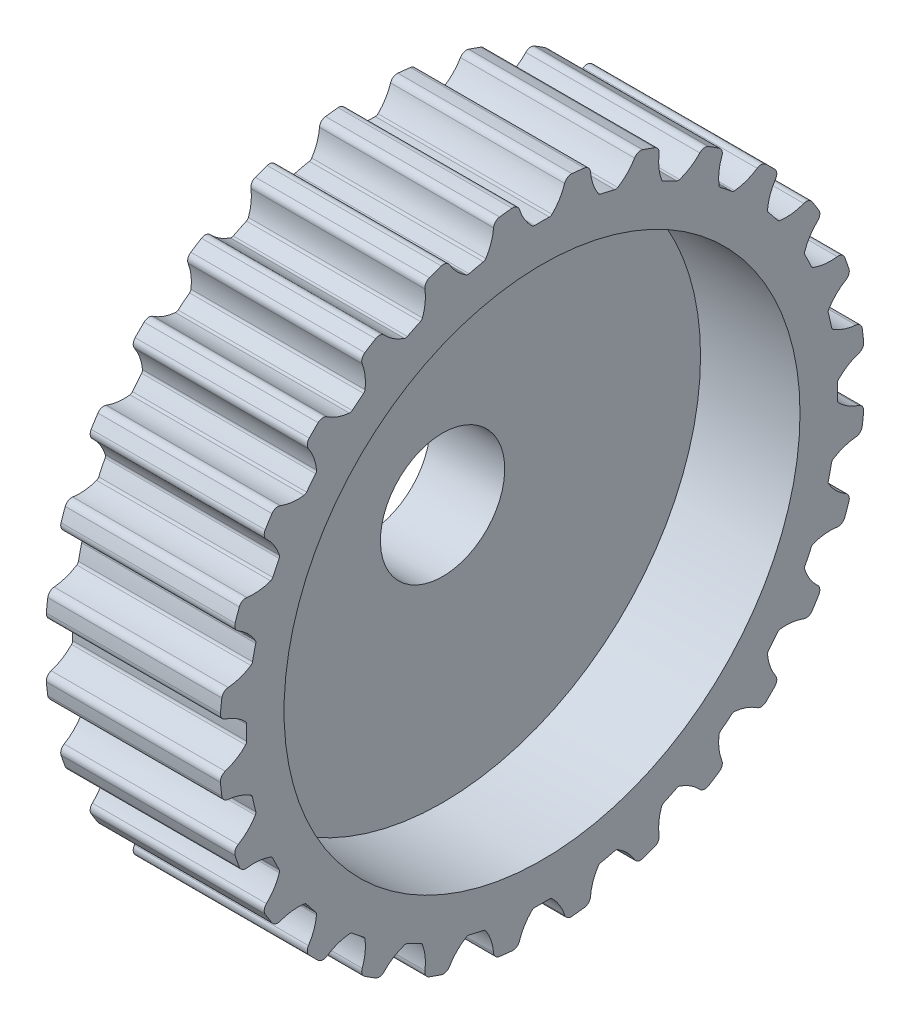
from build123d import *

# Parameters (mm, degrees)
HOLE_WIZARD_1_D          = 5
SKETCH_4_R               = 17.99
CUT_EXTRUDE_1_DEPTH      = 7
CUT_EXTRUDE_2_DEPTH      = 24.895606291
CUT_EXTRUDE_2_DEPTH_BACK = 24.895606291
SKETCH_5_W               = 12.588560779
SKETCH_5_H               = 39.970458518
SKETCH_5_W_2             = 25.674974244
SKETCH_5_H_2             = 50.140877678
SKETCH_6_R               = 10.375
CUT_EXTRUDE_3_DEPTH      = 4


with BuildPart() as part:
    # 草图1 → 旋转1 (revolve)
    with BuildSketch(Plane.XY, mode=Mode.PRIVATE) as revolve_1_sk:
        Polygon((0, 0), (0, 10), (1, 10), (1, 12.858347502), (0.495496297, 14.741180955), (1.461422123, 15), (2, 12.99), (9, 12.99), (9.538577877, 15), (10.504503703, 14.741180955), (10, 12.858347502), (10, 10), (11, 10), (11, 0), align=None)
    revolve(revolve_1_sk.sketch.rotate(Axis((11, 0, 0), (-1, 0, 0)), 270), axis=Axis((11, 0, 0), (-1, 0, 0)))

    # 孔1 (through all)
    with Locations(Plane(origin=(11, 0, 0), x_dir=(0, 0, -1), z_dir=(1, 0, 0))):
        with Locations((0, 0)):
            Hole(HOLE_WIZARD_1_D / 2)

    # 草图4 → 切除-拉伸1 (cut)
    with BuildSketch(Plane(origin=(2, 0, 0), x_dir=(0, 0, -1), z_dir=(1, 0, 0))):
        Circle(SKETCH_4_R)
        with BuildLine():
            ThreePointArc((-12.934335103, 1.201280746), (-12.888789145, 1.020492007), (-12.739828866, 0.908376719))
            ThreePointArc((-12.739828866, 0.908376719), (-12.297942775, 0.706183335), (-11.918804359, 0.402210404))
            ThreePointArc((-11.918804359, 0.402210404), (-11.886657302, 0.352337477), (-11.876364008, 0.293901271))
            ThreePointArc((-11.876364008, 0.293901271), (-11.88, 0), (-11.876364008, -0.293901271))
            ThreePointArc((-11.876364008, -0.293901271), (-11.886657302, -0.352337477), (-11.918804359, -0.402210404))
            ThreePointArc((-11.918804359, -0.402210404), (-12.297942775, -0.706183335), (-12.739828866, -0.908376719))
            ThreePointArc((-12.739828866, -0.908376719), (-12.888789145, -1.020492007), (-12.934335103, -1.201280746))
            ThreePointArc((-12.934335103, -1.201280746), (-12.908321607, -1.454418545), (-12.877354431, -1.706998197))
            ThreePointArc((-12.877354431, -1.706998197), (-12.792721126, -1.873119256), (-12.622547594, -1.9492768))
            ThreePointArc((-12.622547594, -1.9492768), (-12.146748249, -2.048071867), (-11.709475284, -2.260057328))
            ThreePointArc((-11.709475284, -2.260057328), (-11.667036451, -2.301526443), (-11.643997952, -2.356207058))
            ThreePointArc((-11.643997952, -2.356207058), (-11.582143597, -2.643548695), (-11.513199581, -2.929272164))
            ThreePointArc((-11.513199581, -2.929272164), (-11.510231522, -2.988533726), (-11.530474814, -3.044309627))
            ThreePointArc((-11.530474814, -3.044309627), (-11.832467099, -3.425027557), (-12.218281922, -3.720480436))
            ThreePointArc((-12.218281922, -3.720480436), (-12.338559457, -3.86293154), (-12.342734204, -4.049322457))
            ThreePointArc((-12.342734204, -4.049322457), (-12.261044461, -4.290325015), (-12.174649437, -4.529681124))
            ThreePointArc((-12.174649437, -4.529681124), (-12.055172652, -4.672804499), (-11.872319078, -4.70918544))
            ThreePointArc((-11.872319078, -4.70918544), (-11.386465046, -4.699628195), (-10.912984224, -4.808996348))
            ThreePointArc((-10.912984224, -4.808996348), (-10.862381675, -4.839982218), (-10.827753217, -4.888165327))
            ThreePointArc((-10.827753217, -4.888165327), (-10.703510151, -5.154538821), (-10.572715252, -5.417757118))
            ThreePointArc((-10.572715252, -5.417757118), (-10.556634671, -5.474872414), (-10.563959116, -5.533754454))
            ThreePointArc((-10.563959116, -5.533754454), (-10.773662114, -5.972126595), (-11.084059304, -6.346023728))
            ThreePointArc((-11.084059304, -6.346023728), (-11.169622877, -6.511667555), (-11.132217073, -6.694314232))
            ThreePointArc((-11.132217073, -6.694314232), (-10.998947348, -6.911096674), (-10.861456683, -7.125226924))
            ThreePointArc((-10.861456683, -7.125226924), (-10.713127484, -7.238175812), (-10.526762909, -7.232955859))
            ThreePointArc((-10.526762909, -7.232955859), (-10.055216939, -7.11552554), (-9.569270566, -7.116792211))
            ThreePointArc((-9.569270566, -7.116792211), (-9.513041724, -7.135741074), (-9.468559724, -7.175010575))
            ThreePointArc((-9.468559724, -7.175010575), (-9.288158012, -7.407058846), (-9.102070833, -7.634573108))
            ThreePointArc((-9.102070833, -7.634573108), (-9.073684076, -7.686678138), (-9.067722396, -7.745713725))
            ThreePointArc((-9.067722396, -7.745713725), (-9.174620723, -8.219758268), (-9.394035669, -8.653350892))
            ThreePointArc((-9.394035669, -8.653350892), (-9.440594765, -8.833881369), (-9.363484094, -9.003625138))
            ThreePointArc((-9.363484094, -9.003625138), (-9.185317088, -9.185317088), (-9.003625138, -9.363484094))
            ThreePointArc((-9.003625138, -9.363484094), (-8.833881369, -9.440594765), (-8.653350892, -9.394035669))
            ThreePointArc((-8.653350892, -9.394035669), (-8.219758268, -9.174620723), (-7.745713725, -9.067722396))
            ThreePointArc((-7.745713725, -9.067722396), (-7.686678138, -9.073684076), (-7.634573108, -9.102070833))
            ThreePointArc((-7.634573108, -9.102070833), (-7.407058846, -9.288158012), (-7.175010575, -9.468559724))
            ThreePointArc((-7.175010575, -9.468559724), (-7.135741074, -9.513041724), (-7.116792211, -9.569270566))
            ThreePointArc((-7.116792211, -9.569270566), (-7.11552554, -10.055216939), (-7.232955859, -10.526762909))
            ThreePointArc((-7.232955859, -10.526762909), (-7.238175812, -10.713127484), (-7.125226924, -10.861456683))
            ThreePointArc((-7.125226924, -10.861456683), (-6.911096674, -10.998947348), (-6.694314232, -11.132217073))
            ThreePointArc((-6.694314232, -11.132217073), (-6.511667555, -11.169622877), (-6.346023728, -11.084059304))
            ThreePointArc((-6.346023728, -11.084059304), (-5.972126595, -10.773662114), (-5.533754454, -10.563959116))
            ThreePointArc((-5.533754454, -10.563959116), (-5.474872414, -10.556634671), (-5.417757118, -10.572715252))
            ThreePointArc((-5.417757118, -10.572715252), (-5.154538821, -10.703510151), (-4.888165327, -10.827753217))
            ThreePointArc((-4.888165327, -10.827753217), (-4.839982218, -10.862381675), (-4.808996348, -10.912984224))
            ThreePointArc((-4.808996348, -10.912984224), (-4.699628195, -11.386465046), (-4.70918544, -11.872319078))
            ThreePointArc((-4.70918544, -11.872319078), (-4.672804499, -12.055172652), (-4.529681124, -12.174649437))
            ThreePointArc((-4.529681124, -12.174649437), (-4.290325015, -12.261044461), (-4.049322457, -12.342734204))
            ThreePointArc((-4.049322457, -12.342734204), (-3.86293154, -12.338559457), (-3.720480436, -12.218281922))
            ThreePointArc((-3.720480436, -12.218281922), (-3.425027557, -11.832467099), (-3.044309627, -11.530474814))
            ThreePointArc((-3.044309627, -11.530474814), (-2.988533726, -11.510231522), (-2.929272164, -11.513199581))
            ThreePointArc((-2.929272164, -11.513199581), (-2.643548695, -11.582143597), (-2.356207058, -11.643997952))
            ThreePointArc((-2.356207058, -11.643997952), (-2.301526443, -11.667036451), (-2.260057328, -11.709475284))
            ThreePointArc((-2.260057328, -11.709475284), (-2.048071867, -12.146748249), (-1.9492768, -12.622547594))
            ThreePointArc((-1.9492768, -12.622547594), (-1.873119256, -12.792721126), (-1.706998197, -12.877354431))
            ThreePointArc((-1.706998197, -12.877354431), (-1.454418545, -12.908321607), (-1.201280746, -12.934335103))
            ThreePointArc((-1.201280746, -12.934335103), (-1.020492007, -12.888789145), (-0.908376719, -12.739828866))
            ThreePointArc((-0.908376719, -12.739828866), (-0.706183335, -12.297942775), (-0.402210404, -11.918804359))
            ThreePointArc((-0.402210404, -11.918804359), (-0.352337477, -11.886657302), (-0.293901271, -11.876364008))
            ThreePointArc((-0.293901271, -11.876364008), (0, -11.88), (0.293901271, -11.876364008))
            ThreePointArc((0.293901271, -11.876364008), (0.352337477, -11.886657302), (0.402210404, -11.918804359))
            ThreePointArc((0.402210404, -11.918804359), (0.706183335, -12.297942775), (0.908376719, -12.739828866))
            ThreePointArc((0.908376719, -12.739828866), (1.020492007, -12.888789145), (1.201280746, -12.934335103))
            ThreePointArc((1.201280746, -12.934335103), (1.454418545, -12.908321607), (1.706998197, -12.877354431))
            ThreePointArc((1.706998197, -12.877354431), (1.873119256, -12.792721126), (1.9492768, -12.622547594))
            ThreePointArc((1.9492768, -12.622547594), (2.048071867, -12.146748249), (2.260057328, -11.709475284))
            ThreePointArc((2.260057328, -11.709475284), (2.301526443, -11.667036451), (2.356207058, -11.643997952))
            ThreePointArc((2.356207058, -11.643997952), (2.643548695, -11.582143597), (2.929272164, -11.513199581))
            ThreePointArc((2.929272164, -11.513199581), (2.988533726, -11.510231522), (3.044309627, -11.530474814))
            ThreePointArc((3.044309627, -11.530474814), (3.425027557, -11.832467099), (3.720480436, -12.218281922))
            ThreePointArc((3.720480436, -12.218281922), (3.86293154, -12.338559457), (4.049322457, -12.342734204))
            ThreePointArc((4.049322457, -12.342734204), (4.290325015, -12.261044461), (4.529681124, -12.174649437))
            ThreePointArc((4.529681124, -12.174649437), (4.672804499, -12.055172652), (4.70918544, -11.872319078))
            ThreePointArc((4.70918544, -11.872319078), (4.699628195, -11.386465046), (4.808996348, -10.912984224))
            ThreePointArc((4.808996348, -10.912984224), (4.839982218, -10.862381675), (4.888165327, -10.827753217))
            ThreePointArc((4.888165327, -10.827753217), (5.154538821, -10.703510151), (5.417757118, -10.572715252))
            ThreePointArc((5.417757118, -10.572715252), (5.474872414, -10.556634671), (5.533754454, -10.563959116))
            ThreePointArc((5.533754454, -10.563959116), (5.972126595, -10.773662114), (6.346023728, -11.084059304))
            ThreePointArc((6.346023728, -11.084059304), (6.511667555, -11.169622877), (6.694314232, -11.132217073))
            ThreePointArc((6.694314232, -11.132217073), (6.911096674, -10.998947348), (7.125226924, -10.861456683))
            ThreePointArc((7.125226924, -10.861456683), (7.238175812, -10.713127484), (7.232955859, -10.526762909))
            ThreePointArc((7.232955859, -10.526762909), (7.11552554, -10.055216939), (7.116792211, -9.569270566))
            ThreePointArc((7.116792211, -9.569270566), (7.135741074, -9.513041724), (7.175010575, -9.468559724))
            ThreePointArc((7.175010575, -9.468559724), (7.407058846, -9.288158012), (7.634573108, -9.102070833))
            ThreePointArc((7.634573108, -9.102070833), (7.686678138, -9.073684076), (7.745713725, -9.067722396))
            ThreePointArc((7.745713725, -9.067722396), (8.219758268, -9.174620723), (8.653350892, -9.394035669))
            ThreePointArc((8.653350892, -9.394035669), (8.833881369, -9.440594765), (9.003625138, -9.363484094))
            ThreePointArc((9.003625138, -9.363484094), (9.185317088, -9.185317088), (9.363484094, -9.003625138))
            ThreePointArc((9.363484094, -9.003625138), (9.440594765, -8.833881369), (9.394035669, -8.653350892))
            ThreePointArc((9.394035669, -8.653350892), (9.174620723, -8.219758268), (9.067722396, -7.745713725))
            ThreePointArc((9.067722396, -7.745713725), (9.073684076, -7.686678138), (9.102070833, -7.634573108))
            ThreePointArc((9.102070833, -7.634573108), (9.288158012, -7.407058846), (9.468559724, -7.175010575))
            ThreePointArc((9.468559724, -7.175010575), (9.513041724, -7.135741074), (9.569270566, -7.116792211))
            ThreePointArc((9.569270566, -7.116792211), (10.055216939, -7.11552554), (10.526762909, -7.232955859))
            ThreePointArc((10.526762909, -7.232955859), (10.713127484, -7.238175812), (10.861456683, -7.125226924))
            ThreePointArc((10.861456683, -7.125226924), (10.998947348, -6.911096674), (11.132217073, -6.694314232))
            ThreePointArc((11.132217073, -6.694314232), (11.169622877, -6.511667555), (11.084059304, -6.346023728))
            ThreePointArc((11.084059304, -6.346023728), (10.773662114, -5.972126595), (10.563959116, -5.533754454))
            ThreePointArc((10.563959116, -5.533754454), (10.556634671, -5.474872414), (10.572715252, -5.417757118))
            ThreePointArc((10.572715252, -5.417757118), (10.703510151, -5.154538821), (10.827753217, -4.888165327))
            ThreePointArc((10.827753217, -4.888165327), (10.862381675, -4.839982218), (10.912984224, -4.808996348))
            ThreePointArc((10.912984224, -4.808996348), (11.386465046, -4.699628195), (11.872319078, -4.70918544))
            ThreePointArc((11.872319078, -4.70918544), (12.055172652, -4.672804499), (12.174649437, -4.529681124))
            ThreePointArc((12.174649437, -4.529681124), (12.261044461, -4.290325015), (12.342734204, -4.049322457))
            ThreePointArc((12.342734204, -4.049322457), (12.338559457, -3.86293154), (12.218281922, -3.720480436))
            ThreePointArc((12.218281922, -3.720480436), (11.832467099, -3.425027557), (11.530474814, -3.044309627))
            ThreePointArc((11.530474814, -3.044309627), (11.510231522, -2.988533726), (11.513199581, -2.929272164))
            ThreePointArc((11.513199581, -2.929272164), (11.582143597, -2.643548695), (11.643997952, -2.356207058))
            ThreePointArc((11.643997952, -2.356207058), (11.667036451, -2.301526443), (11.709475284, -2.260057328))
            ThreePointArc((11.709475284, -2.260057328), (12.146748249, -2.048071867), (12.622547594, -1.9492768))
            ThreePointArc((12.622547594, -1.9492768), (12.792721126, -1.873119256), (12.877354431, -1.706998197))
            ThreePointArc((12.877354431, -1.706998197), (12.908321607, -1.454418545), (12.934335103, -1.201280746))
            ThreePointArc((12.934335103, -1.201280746), (12.888789145, -1.020492007), (12.739828866, -0.908376719))
            ThreePointArc((12.739828866, -0.908376719), (12.297942775, -0.706183335), (11.918804359, -0.402210404))
            ThreePointArc((11.918804359, -0.402210404), (11.886657302, -0.352337477), (11.876364008, -0.293901271))
            ThreePointArc((11.876364008, -0.293901271), (11.88, 0), (11.876364008, 0.293901271))
            ThreePointArc((11.876364008, 0.293901271), (11.886657302, 0.352337477), (11.918804359, 0.402210404))
            ThreePointArc((11.918804359, 0.402210404), (12.297942775, 0.706183335), (12.739828866, 0.908376719))
            ThreePointArc((12.739828866, 0.908376719), (12.888789145, 1.020492007), (12.934335103, 1.201280746))
            ThreePointArc((12.934335103, 1.201280746), (12.908321607, 1.454418545), (12.877354431, 1.706998197))
            ThreePointArc((12.877354431, 1.706998197), (12.792721126, 1.873119256), (12.622547594, 1.9492768))
            ThreePointArc((12.622547594, 1.9492768), (12.146748249, 2.048071867), (11.709475284, 2.260057328))
            ThreePointArc((11.709475284, 2.260057328), (11.667036451, 2.301526443), (11.643997952, 2.356207058))
            ThreePointArc((11.643997952, 2.356207058), (11.582143597, 2.643548695), (11.513199581, 2.929272164))
            ThreePointArc((11.513199581, 2.929272164), (11.510231522, 2.988533726), (11.530474814, 3.044309627))
            ThreePointArc((11.530474814, 3.044309627), (11.832467099, 3.425027557), (12.218281922, 3.720480436))
            ThreePointArc((12.218281922, 3.720480436), (12.338559457, 3.86293154), (12.342734204, 4.049322457))
            ThreePointArc((12.342734204, 4.049322457), (12.261044461, 4.290325015), (12.174649437, 4.529681124))
            ThreePointArc((12.174649437, 4.529681124), (12.055172652, 4.672804499), (11.872319078, 4.70918544))
            ThreePointArc((11.872319078, 4.70918544), (11.386465046, 4.699628195), (10.912984224, 4.808996348))
            ThreePointArc((10.912984224, 4.808996348), (10.862381675, 4.839982218), (10.827753217, 4.888165327))
            ThreePointArc((10.827753217, 4.888165327), (10.703510151, 5.154538821), (10.572715252, 5.417757118))
            ThreePointArc((10.572715252, 5.417757118), (10.556634671, 5.474872414), (10.563959116, 5.533754454))
            ThreePointArc((10.563959116, 5.533754454), (10.773662114, 5.972126595), (11.084059304, 6.346023728))
            ThreePointArc((11.084059304, 6.346023728), (11.169622877, 6.511667555), (11.132217073, 6.694314232))
            ThreePointArc((11.132217073, 6.694314232), (10.998947348, 6.911096674), (10.861456683, 7.125226924))
            ThreePointArc((10.861456683, 7.125226924), (10.713127484, 7.238175812), (10.526762909, 7.232955859))
            ThreePointArc((10.526762909, 7.232955859), (10.055216939, 7.11552554), (9.569270566, 7.116792211))
            ThreePointArc((9.569270566, 7.116792211), (9.513041724, 7.135741074), (9.468559724, 7.175010575))
            ThreePointArc((9.468559724, 7.175010575), (9.288158012, 7.407058846), (9.102070833, 7.634573108))
            ThreePointArc((9.102070833, 7.634573108), (9.073684076, 7.686678138), (9.067722396, 7.745713725))
            ThreePointArc((9.067722396, 7.745713725), (9.174620723, 8.219758268), (9.394035669, 8.653350892))
            ThreePointArc((9.394035669, 8.653350892), (9.440594765, 8.833881369), (9.363484094, 9.003625138))
            ThreePointArc((9.363484094, 9.003625138), (9.185317088, 9.185317088), (9.003625138, 9.363484094))
            ThreePointArc((9.003625138, 9.363484094), (8.833881369, 9.440594765), (8.653350892, 9.394035669))
            ThreePointArc((8.653350892, 9.394035669), (8.219758268, 9.174620723), (7.745713725, 9.067722396))
            ThreePointArc((7.745713725, 9.067722396), (7.686678138, 9.073684076), (7.634573108, 9.102070833))
            ThreePointArc((7.634573108, 9.102070833), (7.407058846, 9.288158012), (7.175010575, 9.468559724))
            ThreePointArc((7.175010575, 9.468559724), (7.135741074, 9.513041724), (7.116792211, 9.569270566))
            ThreePointArc((7.116792211, 9.569270566), (7.11552554, 10.055216939), (7.232955859, 10.526762909))
            ThreePointArc((7.232955859, 10.526762909), (7.238175812, 10.713127484), (7.125226924, 10.861456683))
            ThreePointArc((7.125226924, 10.861456683), (6.911096674, 10.998947348), (6.694314232, 11.132217073))
            ThreePointArc((6.694314232, 11.132217073), (6.511667555, 11.169622877), (6.346023728, 11.084059304))
            ThreePointArc((6.346023728, 11.084059304), (5.972126595, 10.773662114), (5.533754454, 10.563959116))
            ThreePointArc((5.533754454, 10.563959116), (5.474872414, 10.556634671), (5.417757118, 10.572715252))
            ThreePointArc((5.417757118, 10.572715252), (5.154538821, 10.703510151), (4.888165327, 10.827753217))
            ThreePointArc((4.888165327, 10.827753217), (4.839982218, 10.862381675), (4.808996348, 10.912984224))
            ThreePointArc((4.808996348, 10.912984224), (4.699628195, 11.386465046), (4.70918544, 11.872319078))
            ThreePointArc((4.70918544, 11.872319078), (4.672804499, 12.055172652), (4.529681124, 12.174649437))
            ThreePointArc((4.529681124, 12.174649437), (4.290325015, 12.261044461), (4.049322457, 12.342734204))
            ThreePointArc((4.049322457, 12.342734204), (3.86293154, 12.338559457), (3.720480436, 12.218281922))
            ThreePointArc((3.720480436, 12.218281922), (3.425027557, 11.832467099), (3.044309627, 11.530474814))
            ThreePointArc((3.044309627, 11.530474814), (2.988533726, 11.510231522), (2.929272164, 11.513199581))
            ThreePointArc((2.929272164, 11.513199581), (2.643548695, 11.582143597), (2.356207058, 11.643997952))
            ThreePointArc((2.356207058, 11.643997952), (2.301526443, 11.667036451), (2.260057328, 11.709475284))
            ThreePointArc((2.260057328, 11.709475284), (2.048071867, 12.146748249), (1.9492768, 12.622547594))
            ThreePointArc((1.9492768, 12.622547594), (1.873119256, 12.792721126), (1.706998197, 12.877354431))
            ThreePointArc((1.706998197, 12.877354431), (1.454418545, 12.908321607), (1.201280746, 12.934335103))
            ThreePointArc((1.201280746, 12.934335103), (1.020492007, 12.888789145), (0.908376719, 12.739828866))
            ThreePointArc((0.908376719, 12.739828866), (0.706183335, 12.297942775), (0.402210404, 11.918804359))
            ThreePointArc((0.402210404, 11.918804359), (0.352337477, 11.886657302), (0.293901271, 11.876364008))
            ThreePointArc((0.293901271, 11.876364008), (0, 11.88), (-0.293901271, 11.876364008))
            ThreePointArc((-0.293901271, 11.876364008), (-0.352337477, 11.886657302), (-0.402210404, 11.918804359))
            ThreePointArc((-0.402210404, 11.918804359), (-0.706183335, 12.297942775), (-0.908376719, 12.739828866))
            ThreePointArc((-0.908376719, 12.739828866), (-1.020492007, 12.888789145), (-1.201280746, 12.934335103))
            ThreePointArc((-1.201280746, 12.934335103), (-1.454418545, 12.908321607), (-1.706998197, 12.877354431))
            ThreePointArc((-1.706998197, 12.877354431), (-1.873119256, 12.792721126), (-1.9492768, 12.622547594))
            ThreePointArc((-1.9492768, 12.622547594), (-2.048071867, 12.146748249), (-2.260057328, 11.709475284))
            ThreePointArc((-2.260057328, 11.709475284), (-2.301526443, 11.667036451), (-2.356207058, 11.643997952))
            ThreePointArc((-2.356207058, 11.643997952), (-2.643548695, 11.582143597), (-2.929272164, 11.513199581))
            ThreePointArc((-2.929272164, 11.513199581), (-2.988533726, 11.510231522), (-3.044309627, 11.530474814))
            ThreePointArc((-3.044309627, 11.530474814), (-3.425027557, 11.832467099), (-3.720480436, 12.218281922))
            ThreePointArc((-3.720480436, 12.218281922), (-3.86293154, 12.338559457), (-4.049322457, 12.342734204))
            ThreePointArc((-4.049322457, 12.342734204), (-4.290325015, 12.261044461), (-4.529681124, 12.174649437))
            ThreePointArc((-4.529681124, 12.174649437), (-4.672804499, 12.055172652), (-4.70918544, 11.872319078))
            ThreePointArc((-4.70918544, 11.872319078), (-4.699628195, 11.386465046), (-4.808996348, 10.912984224))
            ThreePointArc((-4.808996348, 10.912984224), (-4.839982218, 10.862381675), (-4.888165327, 10.827753217))
            ThreePointArc((-4.888165327, 10.827753217), (-5.154538821, 10.703510151), (-5.417757118, 10.572715252))
            ThreePointArc((-5.417757118, 10.572715252), (-5.474872414, 10.556634671), (-5.533754454, 10.563959116))
            ThreePointArc((-5.533754454, 10.563959116), (-5.972126595, 10.773662114), (-6.346023728, 11.084059304))
            ThreePointArc((-6.346023728, 11.084059304), (-6.511667555, 11.169622877), (-6.694314232, 11.132217073))
            ThreePointArc((-6.694314232, 11.132217073), (-6.911096674, 10.998947348), (-7.125226924, 10.861456683))
            ThreePointArc((-7.125226924, 10.861456683), (-7.238175812, 10.713127484), (-7.232955859, 10.526762909))
            ThreePointArc((-7.232955859, 10.526762909), (-7.11552554, 10.055216939), (-7.116792211, 9.569270566))
            ThreePointArc((-7.116792211, 9.569270566), (-7.135741074, 9.513041724), (-7.175010575, 9.468559724))
            ThreePointArc((-7.175010575, 9.468559724), (-7.407058846, 9.288158012), (-7.634573108, 9.102070833))
            ThreePointArc((-7.634573108, 9.102070833), (-7.686678138, 9.073684076), (-7.745713725, 9.067722396))
            ThreePointArc((-7.745713725, 9.067722396), (-8.219758268, 9.174620723), (-8.653350892, 9.394035669))
            ThreePointArc((-8.653350892, 9.394035669), (-8.833881369, 9.440594765), (-9.003625138, 9.363484094))
            ThreePointArc((-9.003625138, 9.363484094), (-9.185317088, 9.185317088), (-9.363484094, 9.003625138))
            ThreePointArc((-9.363484094, 9.003625138), (-9.440594765, 8.833881369), (-9.394035669, 8.653350892))
            ThreePointArc((-9.394035669, 8.653350892), (-9.174620723, 8.219758268), (-9.067722396, 7.745713725))
            ThreePointArc((-9.067722396, 7.745713725), (-9.073684076, 7.686678138), (-9.102070833, 7.634573108))
            ThreePointArc((-9.102070833, 7.634573108), (-9.288158012, 7.407058846), (-9.468559724, 7.175010575))
            ThreePointArc((-9.468559724, 7.175010575), (-9.513041724, 7.135741074), (-9.569270566, 7.116792211))
            ThreePointArc((-9.569270566, 7.116792211), (-10.055216939, 7.11552554), (-10.526762909, 7.232955859))
            ThreePointArc((-10.526762909, 7.232955859), (-10.713127484, 7.238175812), (-10.861456683, 7.125226924))
            ThreePointArc((-10.861456683, 7.125226924), (-10.998947348, 6.911096674), (-11.132217073, 6.694314232))
            ThreePointArc((-11.132217073, 6.694314232), (-11.169622877, 6.511667555), (-11.084059304, 6.346023728))
            ThreePointArc((-11.084059304, 6.346023728), (-10.773662114, 5.972126595), (-10.563959116, 5.533754454))
            ThreePointArc((-10.563959116, 5.533754454), (-10.556634671, 5.474872414), (-10.572715252, 5.417757118))
            ThreePointArc((-10.572715252, 5.417757118), (-10.703510151, 5.154538821), (-10.827753217, 4.888165327))
            ThreePointArc((-10.827753217, 4.888165327), (-10.862381675, 4.839982218), (-10.912984224, 4.808996348))
            ThreePointArc((-10.912984224, 4.808996348), (-11.386465046, 4.699628195), (-11.872319078, 4.70918544))
            ThreePointArc((-11.872319078, 4.70918544), (-12.055172652, 4.672804499), (-12.174649437, 4.529681124))
            ThreePointArc((-12.174649437, 4.529681124), (-12.261044461, 4.290325015), (-12.342734204, 4.049322457))
            ThreePointArc((-12.342734204, 4.049322457), (-12.338559457, 3.86293154), (-12.218281922, 3.720480436))
            ThreePointArc((-12.218281922, 3.720480436), (-11.832467099, 3.425027557), (-11.530474814, 3.044309627))
            ThreePointArc((-11.530474814, 3.044309627), (-11.510231522, 2.988533726), (-11.513199581, 2.929272164))
            ThreePointArc((-11.513199581, 2.929272164), (-11.582143597, 2.643548695), (-11.643997952, 2.356207058))
            ThreePointArc((-11.643997952, 2.356207058), (-11.667036451, 2.301526443), (-11.709475284, 2.260057328))
            ThreePointArc((-11.709475284, 2.260057328), (-12.146748249, 2.048071867), (-12.622547594, 1.9492768))
            ThreePointArc((-12.622547594, 1.9492768), (-12.792721126, 1.873119256), (-12.877354431, 1.706998197))
            ThreePointArc((-12.877354431, 1.706998197), (-12.908321607, 1.454418545), (-12.934335103, 1.201280746))
        make_face(mode=Mode.SUBTRACT)
    extrude(amount=CUT_EXTRUDE_1_DEPTH, mode=Mode.SUBTRACT)

    # 草图5 → 切除-拉伸2 (cut, two sides: drawn at the far end of the back side and taken through both)
    with BuildSketch(Plane.XY.offset(-CUT_EXTRUDE_2_DEPTH_BACK)):
        with Locations((-4.294280389, -1.244631715)):
            Rectangle(SKETCH_5_W, SKETCH_5_H)
        with Locations((21.837487122, 2.560385243)):
            Rectangle(SKETCH_5_W_2, SKETCH_5_H_2)
    extrude(amount=CUT_EXTRUDE_2_DEPTH + CUT_EXTRUDE_2_DEPTH_BACK, mode=Mode.SUBTRACT)

    # 草图6 → 切除-拉伸3 (cut)
    with BuildSketch(Plane(origin=(9, 0, 0), x_dir=(0, 0, -1), z_dir=(1, 0, 0))):
        Circle(SKETCH_6_R)
    extrude(amount=-CUT_EXTRUDE_3_DEPTH, mode=Mode.SUBTRACT)


solid = part.part
